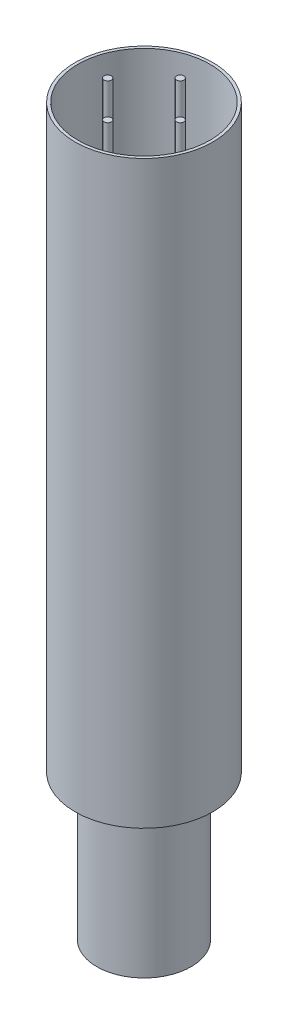
from build123d import *

# Parameters (mm, degrees)
SKETCH1_R             = 32.5
BOSS_EXTRUDE1_DEPTH   = 100
SKETCH2_R             = 47.5
BOSS_EXTRUDE2_DEPTH   = 400
SHELL1_T              = -2
SKETCH3_R             = 2.5
BOSS_EXTRUDE3_DEPTH   = 400
BOSS_EXTRUDE3_2_DEPTH = 400
BOSS_EXTRUDE3_3_DEPTH = 400
BOSS_EXTRUDE3_4_DEPTH = 400


with BuildPart() as part:
    # Sketch1 → Boss-Extrude1 (new body)
    with BuildSketch(Plane(origin=(0, 0, 0), x_dir=(1, 0, 0), z_dir=(0, 1, 0))):
        with Locations(Location((0, 0, 0), (0, 0, 270))):
            Circle(SKETCH1_R)
    extrude(amount=BOSS_EXTRUDE1_DEPTH)

    # Sketch2 → Boss-Extrude2 (add)
    with BuildSketch(Plane(origin=(0, 100, 0), x_dir=(1, 0, 0), z_dir=(0, 1, 0))):
        with Locations(Location((0, 0, 0), (0, 0, 270))):
            Circle(SKETCH2_R)
    extrude(amount=BOSS_EXTRUDE2_DEPTH)

    # Shell1
    shell1_openings = [part.faces().sort_by_distance(p)[0] for p in [
        (0, 500, 0),
    ]]
    offset(amount=SHELL1_T, openings=shell1_openings, kind=Kind.INTERSECTION)


with BuildPart() as body_2:
    # Sketch3 → Boss-Extrude3 (new body)
    with BuildSketch(Plane(origin=(0, 102, 0), x_dir=(1, 0, 0), z_dir=(0, 1, 0))):
        with Locations(Location((-25, 0, 0), (0, 0, 270))):
            Circle(SKETCH3_R)
    extrude(amount=BOSS_EXTRUDE3_DEPTH)


with BuildPart() as body_3:
    # Sketch3 → Boss-Extrude3 2 (new body)
    with BuildSketch(Plane(origin=(0, 102, 0), x_dir=(1, 0, 0), z_dir=(0, 1, 0))):
        with Locations(Location((0, 25, 0), (0, 0, 270))):
            Circle(SKETCH3_R)
    extrude(amount=BOSS_EXTRUDE3_2_DEPTH)


with BuildPart() as body_4:
    # Sketch3 → Boss-Extrude3 3 (new body)
    with BuildSketch(Plane(origin=(0, 102, 0), x_dir=(1, 0, 0), z_dir=(0, 1, 0))):
        with Locations(Location((25, 0, 0), (0, 0, 270))):
            Circle(SKETCH3_R)
    extrude(amount=BOSS_EXTRUDE3_3_DEPTH)


with BuildPart() as body_5:
    # Sketch3 → Boss-Extrude3 4 (new body)
    with BuildSketch(Plane(origin=(0, 102, 0), x_dir=(1, 0, 0), z_dir=(0, 1, 0))):
        with Locations(Location((0, -25, 0), (0, 0, 270))):
            Circle(SKETCH3_R)
    extrude(amount=BOSS_EXTRUDE3_4_DEPTH)


solid = Compound([part.part, body_2.part, body_3.part, body_4.part, body_5.part])
